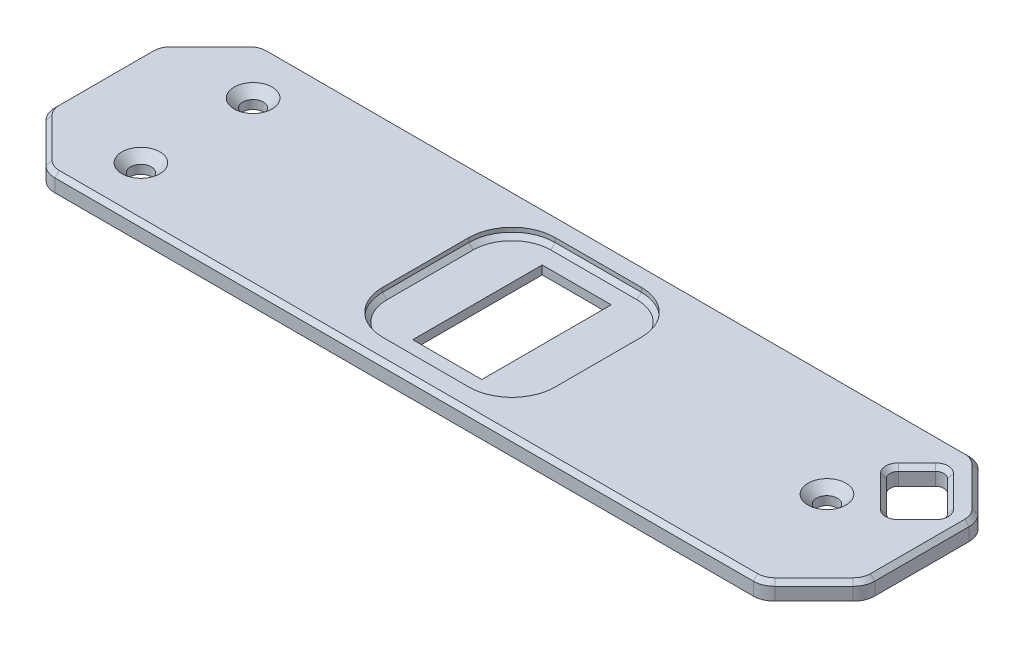
from build123d import *

# Parameters (mm, degrees)
BOSS_EXTRUDE1_DEPTH                                 = 2
FILLET1_R                                           = 2.5
SKETCH2_W                                           = 8
SKETCH2_H                                           = 15
CUT_EXTRUDE1_DEPTH                                  = 2
CUT_EXTRUDE2_DEPTH                                  = 1
FILLET3_SIZE                                        = 0.5
FILLET4_SIZE                                        = 0.5
CUT_EXTRUDE3_DEPTH                                  = 50.157908825
FILLET5_SIZE                                        = 0.5
CSK_FOR_M2_COUNTERSUNK_FLAT_HEAD_SCREW1_D           = 2.4
CSK_FOR_M2_COUNTERSUNK_FLAT_HEAD_SCREW1_DEPTH       = 4.278967257
CSK_FOR_M2_COUNTERSUNK_FLAT_HEAD_SCREW1_CSINK_D     = 4.4
CSK_FOR_M2_COUNTERSUNK_FLAT_HEAD_SCREW1_CSINK_ANGLE = 90
CSK_FOR_M2_COUNTERSUNK_FLAT_HEAD_SCREW1_TIP         = 0.721032743
CSK_FOR_M2_COUNTERSUNK_FLAT_HEAD_SCREW2_D           = 2.4
CSK_FOR_M2_COUNTERSUNK_FLAT_HEAD_SCREW2_DEPTH       = 4.278967257
CSK_FOR_M2_COUNTERSUNK_FLAT_HEAD_SCREW2_CSINK_D     = 4.4
CSK_FOR_M2_COUNTERSUNK_FLAT_HEAD_SCREW2_CSINK_ANGLE = 90
CSK_FOR_M2_COUNTERSUNK_FLAT_HEAD_SCREW2_TIP         = 0.721032743


with BuildPart() as part:
    # Sketch1 → Boss-Extrude1 (new body)
    with BuildSketch(Plane(origin=(0, 0, 0), x_dir=(1, 0, 0), z_dir=(0, 1, 0))):
        Polygon((-47.5, 6.5), (-41.5, 12.5), (41.5, 12.5), (47.5, 6.5), (47.5, -6.5), (41.5, -12.5), (-41.5, -12.5), (-47.5, -6.5), align=None)
    extrude(amount=BOSS_EXTRUDE1_DEPTH)

    # Fillet1
    fillet1_edges = [part.edges().sort_by_distance(p)[0] for p in [
        (41.5, 1, -12.5),
        (47.5, 1, -6.5),
        (47.5, 1, 6.5),
        (41.5, 1, 12.5),
        (-41.5, 1, 12.5),
        (-47.5, 1, 6.5),
        (-47.5, 1, -6.5),
        (-41.5, 1, -12.5),
    ]]
    fillet(fillet1_edges, radius=FILLET1_R)

    # Sketch2 → Cut-Extrude1 (cut)
    with BuildSketch(Plane(origin=(0, 2, 0), x_dir=(1, 0, 0), z_dir=(0, 1, 0))):
        Rectangle(SKETCH2_W, SKETCH2_H)
    extrude(amount=-CUT_EXTRUDE1_DEPTH, mode=Mode.SUBTRACT)

    # Sketch3 → Cut-Extrude2 (cut)
    with BuildSketch(Plane(origin=(0, 2, 0), x_dir=(1, 0, 0), z_dir=(0, 1, 0))):
        with BuildLine():
            Line((-5, -10), (5, -10))
            ThreePointArc((5, -10), (8.535533906, -8.535533906), (10, -5))
            Line((10, -5), (10, 5))
            ThreePointArc((10, 5), (8.535533906, 8.535533906), (5, 10))
            Line((5, 10), (-5, 10))
            ThreePointArc((-5, 10), (-8.535533906, 8.535533906), (-10, 5))
            Line((-10, 5), (-10, -5))
            ThreePointArc((-10, -5), (-8.535533906, -8.535533906), (-5, -10))
        make_face()
    extrude(amount=-CUT_EXTRUDE2_DEPTH, mode=Mode.SUBTRACT)

    # Fillet3
    fillet3_edges = [part.edges().sort_by_distance(p)[0] for p in [
        (-8.535533906, 1, 8.535533906),
        (-10, 1, 0),
        (-8.535533906, 1, -8.535533906),
        (0, 1, -10),
        (8.535533906, 1, -8.535533906),
        (10, 1, 0),
        (8.535533906, 1, 8.535533906),
        (0, 1, 10),
    ]]
    chamfer(fillet3_edges, length=FILLET3_SIZE)

    # Fillet4
    fillet4_edges = [part.edges().sort_by_distance(p)[0] for p in [
        (0, 2, 12.5),
        (-44.5, 2, 9.5),
        (0, 2, -12.5),
        (-44.5, 2, -9.5),
        (-47.5, 2, 0),
        (44.5, 2, 9.5),
        (47.5, 2, 0),
        (44.5, 2, -9.5),
        (41.421174675, 2, 12.309698831),
        (47.309698831, 2, 6.421174675),
        (47.309698831, 2, -6.421174675),
        (41.421174675, 2, -12.309698831),
        (-41.421174675, 2, -12.309698831),
        (-47.309698831, 2, -6.421174675),
        (-47.309698831, 2, 6.421174675),
        (-41.421174675, 2, 12.309698831),
    ]]
    chamfer(fillet4_edges, length=FILLET4_SIZE)

    # Sketch5 → Cut-Extrude3 (cut, through all)
    with BuildSketch(Plane(origin=(0, 2, 0), x_dir=(1, 0, 0), z_dir=(0, 1, 0))):
        with BuildLine():
            Line((39.98959236, 9.060660172), (37.868272016, 6.939339828))
            ThreePointArc((37.868272016, 6.939339828), (37.575378798, 6.232233047), (37.868272016, 5.525126266))
            Line((37.868272016, 5.525126266), (41.454058454, 1.939339828))
            ThreePointArc((41.454058454, 1.939339828), (42.161165235, 1.646446609), (42.868272016, 1.939339828))
            Line((42.868272016, 1.939339828), (44.98959236, 4.060660172))
            ThreePointArc((44.98959236, 4.060660172), (45.282485579, 4.767766953), (44.98959236, 5.474873734))
            Line((44.98959236, 5.474873734), (41.403805922, 9.060660172))
            ThreePointArc((41.403805922, 9.060660172), (40.696699141, 9.353553391), (39.98959236, 9.060660172))
        make_face()
    extrude(amount=-CUT_EXTRUDE3_DEPTH, mode=Mode.SUBTRACT)

    # Fillet5
    fillet5_edges = [part.edges().sort_by_distance(p)[0] for p in [
        (40.696699141, 2, -9.353553391),
        (43.196699141, 2, -7.267766953),
        (45.282485579, 2, -4.767766953),
        (43.928932188, 2, -3),
        (42.161165235, 2, -1.646446609),
        (38.928932188, 2, -8),
        (37.575378798, 2, -6.232233047),
        (39.661165235, 2, -3.732233047),
    ]]
    chamfer(fillet5_edges, length=FILLET5_SIZE)

    # CSK for M2 Countersunk Flat Head Screw1
    with Locations(Plane(origin=(36.5, 2, 0), x_dir=(0, 0, 1), z_dir=(0, 1, 0))):
        with Locations((0, 0)):
            CounterSinkHole(CSK_FOR_M2_COUNTERSUNK_FLAT_HEAD_SCREW1_D / 2, CSK_FOR_M2_COUNTERSUNK_FLAT_HEAD_SCREW1_CSINK_D / 2, depth=CSK_FOR_M2_COUNTERSUNK_FLAT_HEAD_SCREW1_DEPTH, counter_sink_angle=CSK_FOR_M2_COUNTERSUNK_FLAT_HEAD_SCREW1_CSINK_ANGLE)
            with Locations((0, 0, -(CSK_FOR_M2_COUNTERSUNK_FLAT_HEAD_SCREW1_DEPTH + CSK_FOR_M2_COUNTERSUNK_FLAT_HEAD_SCREW1_TIP / 2))):  # 118° drill point
                Cone(0, CSK_FOR_M2_COUNTERSUNK_FLAT_HEAD_SCREW1_D / 2, CSK_FOR_M2_COUNTERSUNK_FLAT_HEAD_SCREW1_TIP, mode=Mode.SUBTRACT)

    # CSK for M2 Countersunk Flat Head Screw2
    with Locations(Plane(origin=(-36.5, 2, -6.5), x_dir=(0, 0, 1), z_dir=(0, 1, 0))):
        with Locations((0, 0), (13, 0)):
            CounterSinkHole(CSK_FOR_M2_COUNTERSUNK_FLAT_HEAD_SCREW2_D / 2, CSK_FOR_M2_COUNTERSUNK_FLAT_HEAD_SCREW2_CSINK_D / 2, depth=CSK_FOR_M2_COUNTERSUNK_FLAT_HEAD_SCREW2_DEPTH, counter_sink_angle=CSK_FOR_M2_COUNTERSUNK_FLAT_HEAD_SCREW2_CSINK_ANGLE)
            with Locations((0, 0, -(CSK_FOR_M2_COUNTERSUNK_FLAT_HEAD_SCREW2_DEPTH + CSK_FOR_M2_COUNTERSUNK_FLAT_HEAD_SCREW2_TIP / 2))):  # 118° drill point
                Cone(0, CSK_FOR_M2_COUNTERSUNK_FLAT_HEAD_SCREW2_D / 2, CSK_FOR_M2_COUNTERSUNK_FLAT_HEAD_SCREW2_TIP, mode=Mode.SUBTRACT)


solid = part.part
